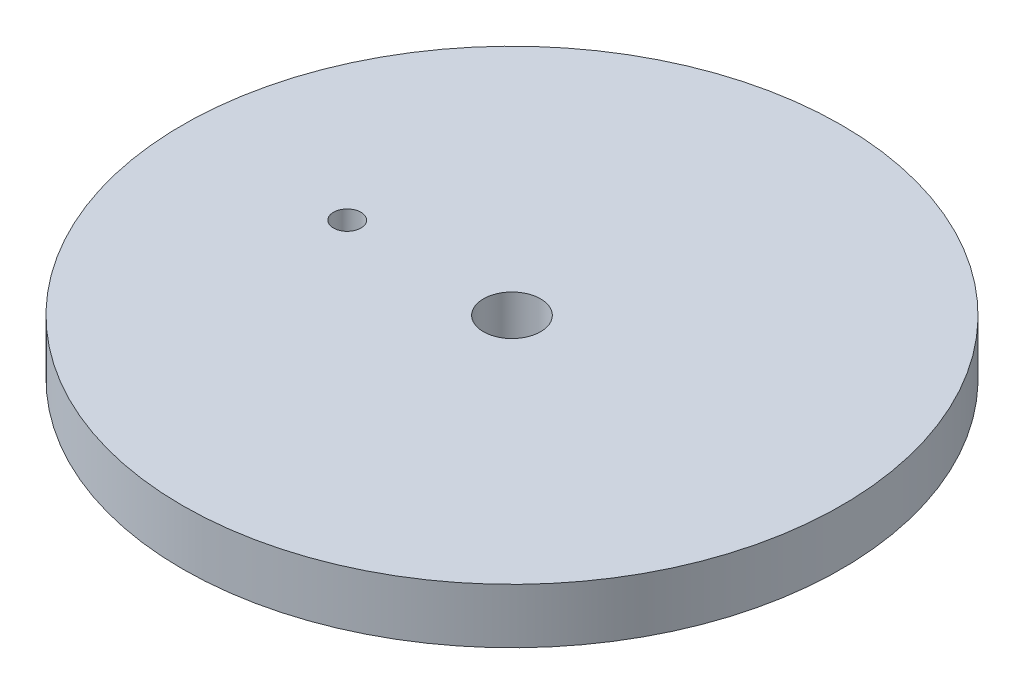
from build123d import *

# Parameters (mm, degrees)
SKETCH1_R           = 38.1
SKETCH1_R_2         = 3.302
SKETCH1_R_3         = 1.5875
BOSS_EXTRUDE1_DEPTH = 6.35


with BuildPart() as part:
    # Sketch1 → Boss-Extrude1 (new body)
    with BuildSketch(Plane(origin=(0, 0, 0), x_dir=(1, 0, 0), z_dir=(0, 1, 0))):
        Circle(SKETCH1_R)
        Circle(SKETCH1_R_2, mode=Mode.SUBTRACT)
        with Locations((-19.05, 0)):
            Circle(SKETCH1_R_3, mode=Mode.SUBTRACT)
    extrude(amount=BOSS_EXTRUDE1_DEPTH)


solid = part.part
